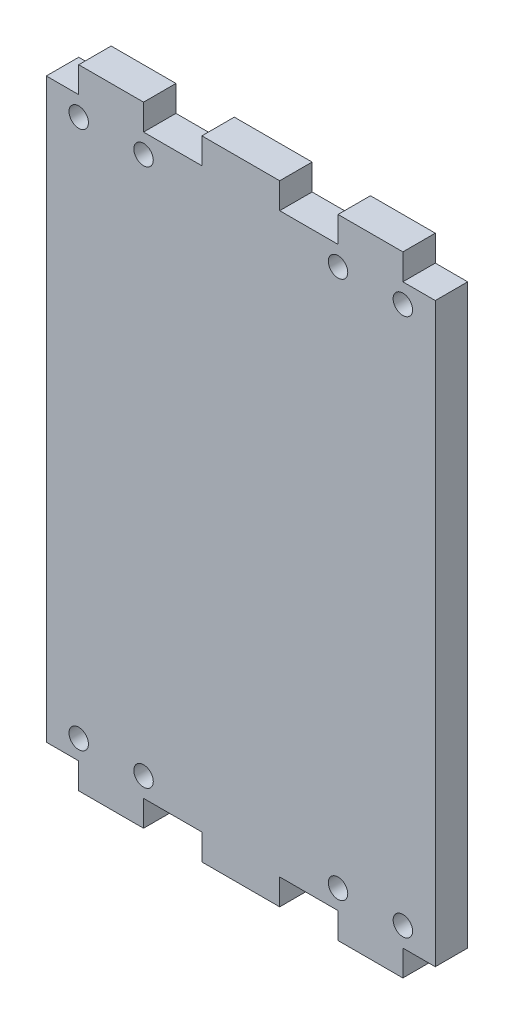
from build123d import *

# Parameters (mm, degrees)
SKETCH_1_W          = 60
SKETCH_1_H          = 97
EXTRUDE_1_DEPTH     = 5
SKETCH_2_OUTSIDE_W  = 84.834
SKETCH_2_OUTSIDE_H  = 121.834
CUT_EXTRUDE_1_DEPTH = 10
SKETCH_3_R          = 1.5
CUT_EXTRUDE_2_DEPTH = 10


with BuildPart() as part:
    # 草图1 → 凸台-拉伸1 (new body)
    with BuildSketch(Plane.XY):
        Rectangle(SKETCH_1_W, SKETCH_1_H)
    extrude(amount=EXTRUDE_1_DEPTH)

    # 草图2 outside → 切除-拉伸1 (cut)
    with BuildSketch(Plane.XY.offset(5)):
        Rectangle(SKETCH_2_OUTSIDE_W, SKETCH_2_OUTSIDE_H)
        Polygon((6, 48.5), (-6, 48.5), (-6, 44.5), (-15, 44.5), (-15, 48.5), (-25, 48.5), (-25, 44.5), (-30, 44.5), (-30, -44.5), (-25, -44.5), (-25, -48.5), (-15, -48.5), (-15, -44.5), (-6, -44.5), (-6, -48.5), (6, -48.5), (6, -44.5), (15, -44.5), (15, -48.5), (25, -48.5), (25, -44.5), (30, -44.5), (30, 44.5), (25, 44.5), (25, 48.5), (15, 48.5), (15, 44.5), (6, 44.5), align=None, mode=Mode.SUBTRACT)
    extrude(amount=-CUT_EXTRUDE_1_DEPTH, mode=Mode.SUBTRACT)

    # 草图3 → 切除-拉伸2 (cut)
    with BuildSketch(Plane.XY.offset(5)):
        with Locations((-25, 41.5)):
            Circle(SKETCH_3_R)
        with Locations((-15.000001244, 41.504987561)):
            Circle(SKETCH_3_R)
        with Locations((15.000001244, 41.504987561)):
            Circle(SKETCH_3_R)
        with Locations((25, 41.5)):
            Circle(SKETCH_3_R)
        with Locations((25, -41.5)):
            Circle(SKETCH_3_R)
        with Locations((15.000001244, -41.504987561)):
            Circle(SKETCH_3_R)
        with Locations((-15.000001244, -41.504987561)):
            Circle(SKETCH_3_R)
        with Locations((-25, -41.5)):
            Circle(SKETCH_3_R)
    extrude(amount=-CUT_EXTRUDE_2_DEPTH, mode=Mode.SUBTRACT)


solid = part.part
